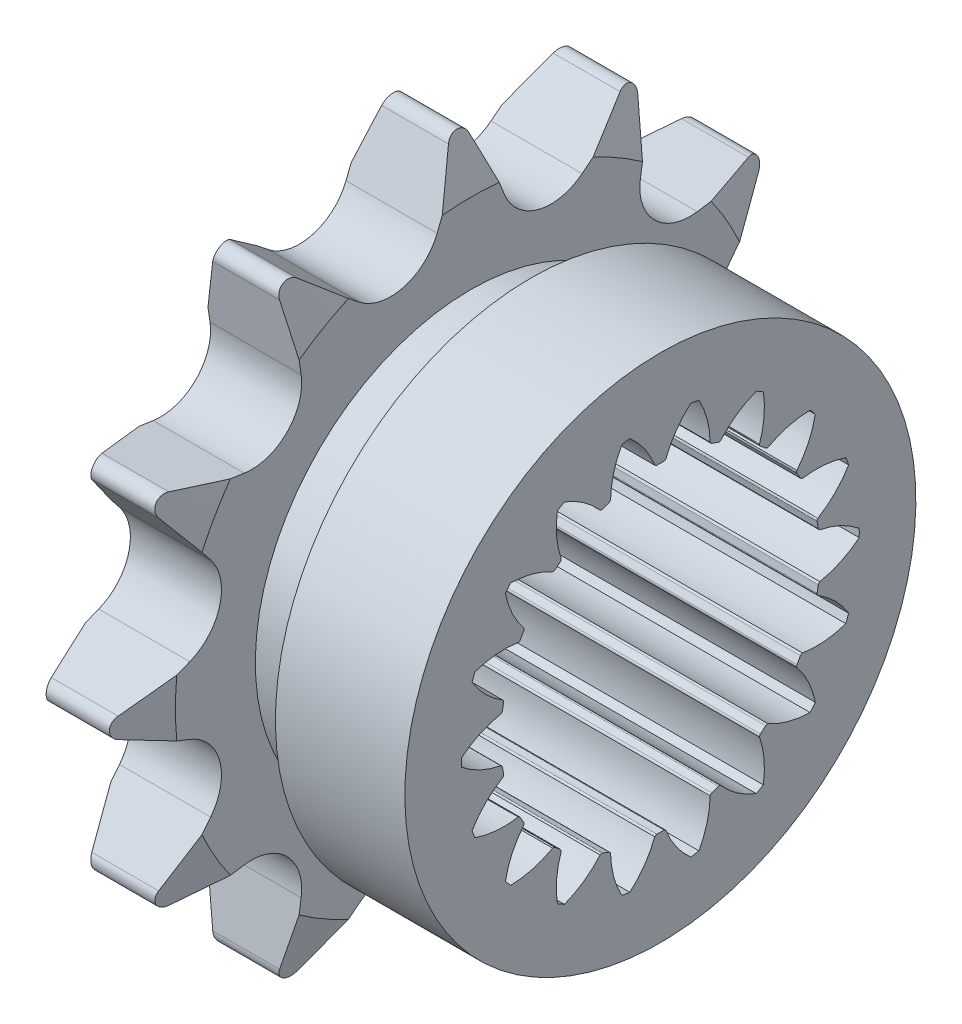
from build123d import *

# Parameters (mm, degrees)
SKETCH13_W         = 22.225
SKETCH13_H         = 27.5082
CUT_EXTRUDE1_DEPTH = 7.2136
CIRPATTERN1_COUNT  = 12
SKETCH15_W         = 127
SKETCH15_H         = 22.5171
SKETCH16_W         = 4.7625
SKETCH16_H         = 3.175
CUT_EXTRUDE2_DEPTH = 45.803490606


with BuildPart() as part:
    # Sketch13 → Revolve1 (revolve)
    with BuildSketch(Plane.XY):
        with Locations((11.1125, 13.7541)):
            Rectangle(SKETCH13_W, SKETCH13_H)
    revolve(axis=Axis((0, 0, 0), (-1, 0, 0)))

    # Sketch6 → Cut-Extrude1 (cut)
    with BuildSketch(Plane(origin=(0, -16.51, 0), x_dir=(0, 0, -1), z_dir=(1, 0, 0))):
        with BuildLine():
            Line((-0.805715716, 43.469749783), (-2.663822441, 38.756002806))
            ThreePointArc((-2.663822441, 38.756002806), (-5.324614334, 36.381731224), (-8.816063498, 37.107514783))
            Line((-8.816063498, 37.107514783), (-12.782104613, 40.260686049))
            ThreePointArc((-12.782104613, 40.260686049), (-13.256994885, 40.44645554), (-13.7541, 40.332800012))
            ThreePointArc((-13.7541, 40.332800012), (-7.119646056, 43.080880815), (0, 44.0182))
            ThreePointArc((0, 44.0182), (-0.487333422, 43.868076017), (-0.805715716, 43.469749783))
        make_face()
    cut_extrude1 = extrude(amount=CUT_EXTRUDE1_DEPTH, mode=Mode.SUBTRACT)

    # CirPattern1: Cut-Extrude1 ×12 about axis
    cirpattern1_axis = Axis((0, 0, 0), (1, 0, 0))
    for i in range(1, CIRPATTERN1_COUNT):
        add(cut_extrude1.rotate(cirpattern1_axis, i * 360 / CIRPATTERN1_COUNT), mode=Mode.SUBTRACT)

    # Sketch15 → hub Cut-Revolve3 (revolve, cut)
    with BuildSketch(Plane.XY):
        with Locations((70.7136, 31.48965)):
            Rectangle(SKETCH15_W, SKETCH15_H)
        with Locations((-63.5, 31.48965)):
            Rectangle(SKETCH15_W, SKETCH15_H)
    revolve(axis=Axis((0, 0, 0), (-1, 0, 0)), mode=Mode.SUBTRACT)

    # Sketch4 → Teeth Chamfer (revolve, cut)
    with BuildSketch(Plane.XY):
        Polygon((0, 27.5082), (1.104501883, 27.5082), (0, 23.386142857), align=None)
        Polygon((7.2136, 27.5082), (6.109098117, 27.5082), (7.2136, 23.386142857), align=None)
    revolve(axis=Axis((0, 0, 0), (-1, 0, 0)), mode=Mode.SUBTRACT)

    # Sketch16 → Recess (revolve, cut)
    with BuildSketch(Plane.XY):
        with Locations((9.59485, 18.6436)):
            Rectangle(SKETCH16_W, SKETCH16_H)
    revolve(axis=Axis((0, 0, 0), (-1, 0, 0)), mode=Mode.SUBTRACT)

    # Sketch36 → Cut-Extrude2 (cut, through all)
    with BuildSketch(Plane.ZY):
        with BuildLine():
            ThreePointArc((-4.7729934, 11.8201419), (-6.061029895, 12.982143528), (-7.592553624, 13.796834183))
            ThreePointArc((-7.592553624, 13.796834183), (-7.873999984, 13.638168068), (-8.152132052, 13.473761428))
            ThreePointArc((-8.152132052, 13.473761428), (-8.212351117, 11.740077645), (-7.850046439, 10.043604504))
            ThreePointArc((-7.850046439, 10.043604504), (-7.86626214, 9.947703548), (-7.918307228, 9.865537551))
            ThreePointArc((-7.918307228, 9.865537551), (-8.13141367, 9.690641477), (-8.340658225, 9.511142985))
            ThreePointArc((-8.340658225, 9.511142985), (-8.430613472, 9.474156555), (-8.527873304, 9.474840233))
            ThreePointArc((-8.527873304, 9.474840233), (-10.135659657, 10.126230162), (-11.853461818, 10.367976993))
            ThreePointArc((-11.853461818, 10.367976993), (-12.063667879, 10.122619291), (-12.268796147, 9.873000815))
            ThreePointArc((-12.268796147, 9.873000815), (-11.732428783, 8.223274824), (-10.811745764, 6.753027031))
            ThreePointArc((-10.811745764, 6.753027031), (-10.794183479, 6.657363513), (-10.814987438, 6.562352263))
            ThreePointArc((-10.814987438, 6.562352263), (-10.95542401, 6.325117018), (-11.090657474, 6.084877757))
            ThreePointArc((-11.090657474, 6.084877757), (-11.162537651, 6.019355375), (-11.254165829, 5.986733001))
            ThreePointArc((-11.254165829, 5.986733001), (-12.987779277, 6.048943991), (-14.684667578, 5.688588763))
            ThreePointArc((-14.684667578, 5.688588763), (-14.798279386, 5.386133234), (-14.905662359, 5.081410594))
            ThreePointArc((-14.905662359, 5.081410594), (-13.837402385, 3.714623697), (-12.469388985, 2.647934833))
            ThreePointArc((-12.469388985, 2.647934833), (-12.420166986, 2.564047187), (-12.407220551, 2.467650443))
            ThreePointArc((-12.407220551, 2.467650443), (-12.458048528, 2.196690097), (-12.50295975, 1.924686467))
            ThreePointArc((-12.50295975, 1.924686467), (-12.548095048, 1.8385311), (-12.623039862, 1.776537414))
            ThreePointArc((-12.623039862, 1.776537414), (-14.273381038, 1.242065902), (-15.744685706, 0.323072774))
            ThreePointArc((-15.744685706, 0.323072774), (-15.748, 1.8e-08), (-15.744685707, -0.323072738))
            ThreePointArc((-15.744685707, -0.323072738), (-14.273381041, -1.24206587), (-12.623039866, -1.776537385))
            ThreePointArc((-12.623039866, -1.776537385), (-12.548095052, -1.838531072), (-12.502959755, -1.924686439))
            ThreePointArc((-12.502959755, -1.924686439), (-12.458048533, -2.196690069), (-12.407220557, -2.467650415))
            ThreePointArc((-12.407220557, -2.467650415), (-12.420166992, -2.564047159), (-12.469388991, -2.647934805))
            ThreePointArc((-12.469388991, -2.647934805), (-13.837402393, -3.714623666), (-14.905662371, -5.08141056))
            ThreePointArc((-14.905662371, -5.08141056), (-14.798279398, -5.3861332), (-14.684667591, -5.68858873))
            ThreePointArc((-14.684667591, -5.68858873), (-12.987779291, -6.048943962), (-11.254165843, -5.986732975))
            ThreePointArc((-11.254165843, -5.986732975), (-11.162537665, -6.01935535), (-11.090657488, -6.084877731))
            ThreePointArc((-11.090657488, -6.084877731), (-10.955424024, -6.325116993), (-10.814987453, -6.562352239))
            ThreePointArc((-10.814987453, -6.562352239), (-10.794183495, -6.657363489), (-10.811745779, -6.753027006))
            ThreePointArc((-10.811745779, -6.753027006), (-11.732428801, -8.223274797), (-12.26879617, -9.873000787))
            ThreePointArc((-12.26879617, -9.873000787), (-12.063667902, -10.122619264), (-11.853461841, -10.367976966))
            ThreePointArc((-11.853461841, -10.367976966), (-10.13565968, -10.126230139), (-8.527873325, -9.474840214))
            ThreePointArc((-8.527873325, -9.474840214), (-8.430613493, -9.474156536), (-8.340658247, -9.511142966))
            ThreePointArc((-8.340658247, -9.511142966), (-8.131413692, -9.690641459), (-7.91830725, -9.865537533))
            ThreePointArc((-7.91830725, -9.865537533), (-7.866262163, -9.94770353), (-7.850046462, -10.043604486))
            ThreePointArc((-7.850046462, -10.043604486), (-8.212351144, -11.740077626), (-8.152132082, -13.473761409))
            ThreePointArc((-8.152132082, -13.473761409), (-7.874000016, -13.63816805), (-7.592553655, -13.796834166))
            ThreePointArc((-7.592553655, -13.796834166), (-6.061029924, -12.982143514), (-4.772993427, -11.820141889))
            ThreePointArc((-4.772993427, -11.820141889), (-4.681832912, -11.78623462), (-4.584652527, -11.79022399))
            ThreePointArc((-4.584652527, -11.79022399), (-4.326634863, -11.887331546), (-4.066562331, -11.9787934))
            ThreePointArc((-4.066562331, -11.9787934), (-3.98955352, -12.038203713), (-3.941515687, -12.122775038))
            ThreePointArc((-3.941515687, -12.122775038), (-3.701742737, -13.840853828), (-3.052200553, -15.449387554))
            ThreePointArc((-3.052200553, -15.449387554), (-2.73461152, -15.508752491), (-2.415871444, -15.561589545))
            ThreePointArc((-2.415871444, -15.561589545), (-1.255350509, -14.272218786), (-0.442420079, -12.739760006))
            ThreePointArc((-0.442420079, -12.739760006), (-0.368354185, -12.676718863), (-0.27567005, -12.647229995))
            ThreePointArc((-0.27567005, -12.647229995), (-1.4e-08, -12.65023401), (0.275670021, -12.647229995))
            ThreePointArc((0.275670021, -12.647229995), (0.368354156, -12.676718864), (0.44242005, -12.739760007))
            ThreePointArc((0.44242005, -12.739760007), (1.255350476, -14.272218789), (2.415871408, -15.561589551))
            ThreePointArc((2.415871408, -15.561589551), (2.734611484, -15.508752498), (3.052200518, -15.449387561))
            ThreePointArc((3.052200518, -15.449387561), (3.701742705, -13.840853836), (3.941515659, -12.122775047))
            ThreePointArc((3.941515659, -12.122775047), (3.989553493, -12.038203723), (4.066562304, -11.978793409))
            ThreePointArc((4.066562304, -11.978793409), (4.326634836, -11.887331556), (4.5846525, -11.790224))
            ThreePointArc((4.5846525, -11.790224), (4.681832885, -11.786234631), (4.7729934, -11.8201419))
            ThreePointArc((4.7729934, -11.8201419), (6.061029895, -12.982143528), (7.592553624, -13.796834183))
            ThreePointArc((7.592553624, -13.796834183), (7.873999984, -13.638168068), (8.152132052, -13.473761428))
            ThreePointArc((8.152132052, -13.473761428), (8.212351117, -11.740077645), (7.850046439, -10.043604504))
            ThreePointArc((7.850046439, -10.043604504), (7.86626214, -9.947703548), (7.918307228, -9.865537551))
            ThreePointArc((7.918307228, -9.865537551), (8.13141367, -9.690641477), (8.340658225, -9.511142985))
            ThreePointArc((8.340658225, -9.511142985), (8.430613472, -9.474156555), (8.527873304, -9.474840233))
            ThreePointArc((8.527873304, -9.474840233), (10.135659657, -10.126230162), (11.853461818, -10.367976993))
            ThreePointArc((11.853461818, -10.367976993), (12.063667879, -10.122619291), (12.268796147, -9.873000815))
            ThreePointArc((12.268796147, -9.873000815), (11.732428783, -8.223274824), (10.811745764, -6.753027031))
            ThreePointArc((10.811745764, -6.753027031), (10.794183479, -6.657363513), (10.814987438, -6.562352263))
            ThreePointArc((10.814987438, -6.562352263), (10.95542401, -6.325117018), (11.090657474, -6.084877757))
            ThreePointArc((11.090657474, -6.084877757), (11.162537651, -6.019355375), (11.254165829, -5.986733001))
            ThreePointArc((11.254165829, -5.986733001), (12.987779277, -6.048943991), (14.684667578, -5.688588763))
            ThreePointArc((14.684667578, -5.688588763), (14.798279386, -5.386133234), (14.905662359, -5.081410594))
            ThreePointArc((14.905662359, -5.081410594), (13.837402385, -3.714623697), (12.469388985, -2.647934833))
            ThreePointArc((12.469388985, -2.647934833), (12.420166986, -2.564047187), (12.407220551, -2.467650443))
            ThreePointArc((12.407220551, -2.467650443), (12.458048528, -2.196690097), (12.50295975, -1.924686467))
            ThreePointArc((12.50295975, -1.924686467), (12.548095048, -1.8385311), (12.623039862, -1.776537414))
            ThreePointArc((12.623039862, -1.776537414), (14.273381038, -1.242065902), (15.744685706, -0.323072774))
            ThreePointArc((15.744685706, -0.323072774), (15.748, -1.8e-08), (15.744685707, 0.323072738))
            ThreePointArc((15.744685707, 0.323072738), (14.273381041, 1.24206587), (12.623039866, 1.776537385))
            ThreePointArc((12.623039866, 1.776537385), (12.548095052, 1.838531072), (12.502959755, 1.924686439))
            ThreePointArc((12.502959755, 1.924686439), (12.458048533, 2.196690069), (12.407220557, 2.467650415))
            ThreePointArc((12.407220557, 2.467650415), (12.420166992, 2.564047159), (12.469388991, 2.647934805))
            ThreePointArc((12.469388991, 2.647934805), (13.837402393, 3.714623666), (14.905662371, 5.08141056))
            ThreePointArc((14.905662371, 5.08141056), (14.798279398, 5.3861332), (14.684667591, 5.68858873))
            ThreePointArc((14.684667591, 5.68858873), (12.987779291, 6.048943962), (11.254165843, 5.986732975))
            ThreePointArc((11.254165843, 5.986732975), (11.162537665, 6.01935535), (11.090657488, 6.084877731))
            ThreePointArc((11.090657488, 6.084877731), (10.955424024, 6.325116993), (10.814987453, 6.562352239))
            ThreePointArc((10.814987453, 6.562352239), (10.794183495, 6.657363489), (10.811745779, 6.753027006))
            ThreePointArc((10.811745779, 6.753027006), (11.732428801, 8.223274797), (12.26879617, 9.873000787))
            ThreePointArc((12.26879617, 9.873000787), (12.063667902, 10.122619264), (11.853461841, 10.367976966))
            ThreePointArc((11.853461841, 10.367976966), (10.13565968, 10.126230139), (8.527873325, 9.474840214))
            ThreePointArc((8.527873325, 9.474840214), (8.430613493, 9.474156536), (8.340658247, 9.511142966))
            ThreePointArc((8.340658247, 9.511142966), (8.131413692, 9.690641459), (7.91830725, 9.865537533))
            ThreePointArc((7.91830725, 9.865537533), (7.866262163, 9.94770353), (7.850046462, 10.043604486))
            ThreePointArc((7.850046462, 10.043604486), (8.212351144, 11.740077626), (8.152132082, 13.473761409))
            ThreePointArc((8.152132082, 13.473761409), (7.874000016, 13.63816805), (7.592553655, 13.796834166))
            ThreePointArc((7.592553655, 13.796834166), (6.061029924, 12.982143514), (4.772993427, 11.820141889))
            ThreePointArc((4.772993427, 11.820141889), (4.681832912, 11.78623462), (4.584652527, 11.79022399))
            ThreePointArc((4.584652527, 11.79022399), (4.326634863, 11.887331546), (4.066562331, 11.9787934))
            ThreePointArc((4.066562331, 11.9787934), (3.98955352, 12.038203713), (3.941515687, 12.122775038))
            ThreePointArc((3.941515687, 12.122775038), (3.701742737, 13.840853828), (3.052200553, 15.449387554))
            ThreePointArc((3.052200553, 15.449387554), (2.73461152, 15.508752491), (2.415871444, 15.561589545))
            ThreePointArc((2.415871444, 15.561589545), (1.255350509, 14.272218786), (0.442420079, 12.739760006))
            ThreePointArc((0.442420079, 12.739760006), (0.368354185, 12.676718863), (0.27567005, 12.647229995))
            ThreePointArc((0.27567005, 12.647229995), (1.4e-08, 12.65023401), (-0.275670021, 12.647229995))
            ThreePointArc((-0.275670021, 12.647229995), (-0.368354156, 12.676718864), (-0.44242005, 12.739760007))
            ThreePointArc((-0.44242005, 12.739760007), (-1.255350476, 14.272218789), (-2.415871408, 15.561589551))
            ThreePointArc((-2.415871408, 15.561589551), (-2.734611484, 15.508752498), (-3.052200518, 15.449387561))
            ThreePointArc((-3.052200518, 15.449387561), (-3.701742705, 13.840853836), (-3.941515659, 12.122775047))
            ThreePointArc((-3.941515659, 12.122775047), (-3.989553493, 12.038203723), (-4.066562304, 11.978793409))
            ThreePointArc((-4.066562304, 11.978793409), (-4.326634836, 11.887331556), (-4.5846525, 11.790224))
            ThreePointArc((-4.5846525, 11.790224), (-4.681832885, 11.786234631), (-4.7729934, 11.8201419))
        make_face()
    extrude(amount=-CUT_EXTRUDE2_DEPTH, mode=Mode.SUBTRACT)


solid = part.part
